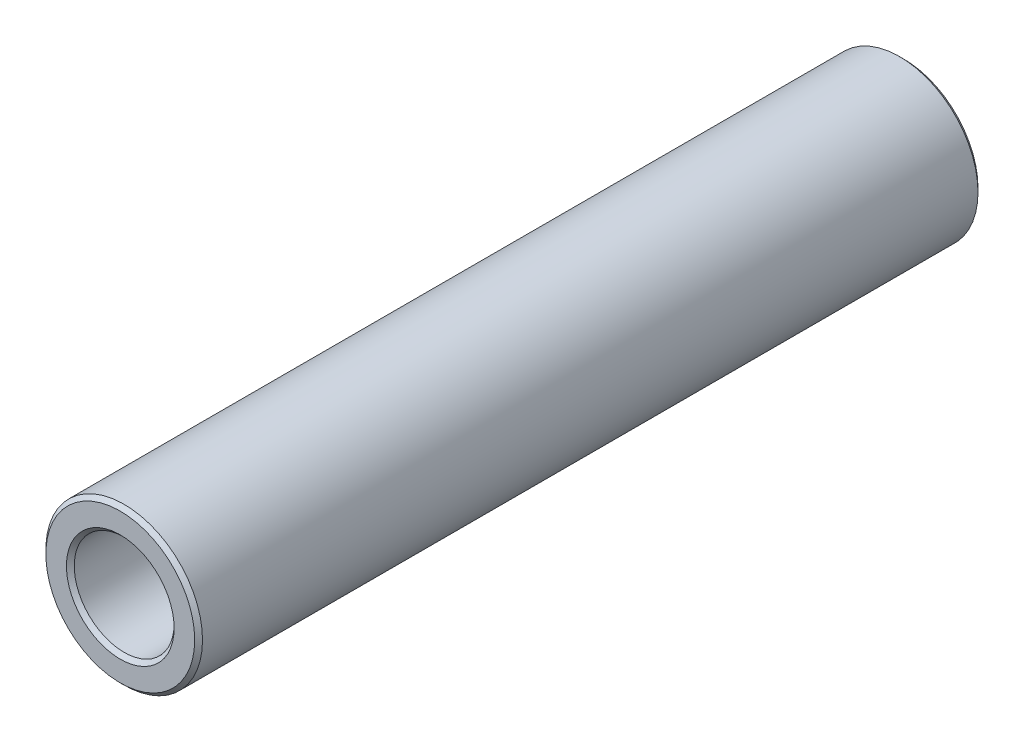
from build123d import *

# Parameters (mm, degrees)
SKETCH1_R           = 4
SKETCH1_R_2         = 2.55
BOSS_EXTRUDE1_DEPTH = 40
CHAMFER1_SIZE       = 0.2


with BuildPart() as part:
    # Sketch1 → Boss-Extrude1 (new body)
    with BuildSketch(Plane.XY):
        Circle(SKETCH1_R)
        Circle(SKETCH1_R_2, mode=Mode.SUBTRACT)
    extrude(amount=BOSS_EXTRUDE1_DEPTH)

    # Chamfer1
    chamfer1_edges = [part.edges().sort_by_distance(p)[0] for p in [
        (-4, 0, 0),
        (-4, 0, 40),
        (-2.55, 0, 0),
        (-2.55, 0, 40),
    ]]
    chamfer(chamfer1_edges, length=CHAMFER1_SIZE)


solid = part.part
